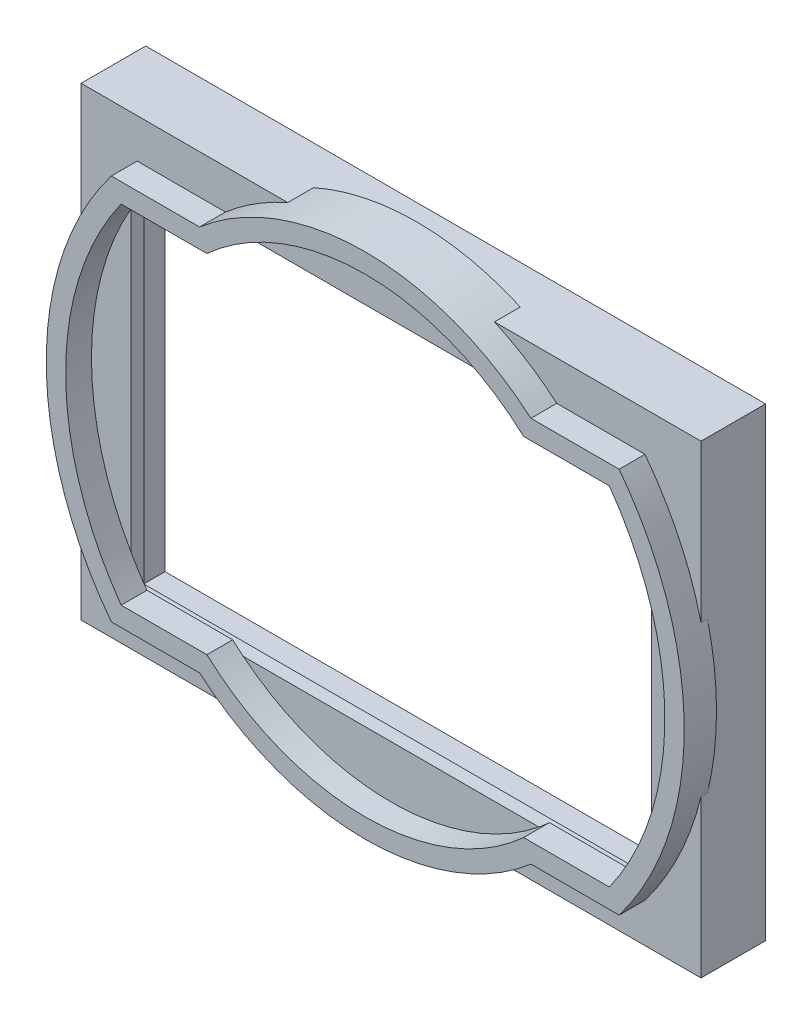
from build123d import *

# Parameters (mm, degrees)
EXTRUDE_1_DEPTH     = 2
EXTRUDE_START       = 2
SKETCH_3_W          = 40.3
SKETCH_3_H          = 28.3
EXTRUDE_2_DEPTH     = 2
SKETCH_4_W          = 48
SKETCH_4_H          = 36
SKETCH_4_W_2        = 45
SKETCH_4_H_2        = 33
EXTRUDE_3_DEPTH     = 3
EXTRUDE_4_DEPTH     = 2
CUT_EXTRUDE_1_DEPTH = 1.5
SKETCH_5_W          = 42.3
SKETCH_5_H          = 30.3
CUT_EXTRUDE_2_DEPTH = 1


with BuildPart() as part:
    # 草图1 → 凸台-拉伸1 (new body)
    with BuildSketch(Plane.XY):
        with BuildLine():
            Line((-19.661828501, 14.95), (-12.82916599, 14.95))
            ThreePointArc((-12.82916599, 14.95), (0, 19.7), (12.82916599, 14.95))
            Line((12.82916599, 14.95), (19.661828501, 14.95))
            ThreePointArc((19.661828501, 14.95), (24.7, 0), (19.661828501, -14.95))
            Line((19.661828501, -14.95), (12.82916599, -14.95))
            ThreePointArc((12.82916599, -14.95), (0, -19.7), (-12.82916599, -14.95))
            Line((-12.82916599, -14.95), (-19.661828501, -14.95))
            ThreePointArc((-19.661828501, -14.95), (-24.7, 0), (-19.661828501, 14.95))
        make_face()
        with BuildLine():
            Line((-18.903372715, 13.45), (-12.261219352, 13.45))
            ThreePointArc((-12.261219352, 13.45), (0, 18.2), (12.261219352, 13.45))
            Line((12.261219352, 13.45), (18.903372715, 13.45))
            ThreePointArc((18.903372715, 13.45), (23.2, 0), (18.903372715, -13.45))
            Line((18.903372715, -13.45), (12.261219352, -13.45))
            ThreePointArc((12.261219352, -13.45), (0, -18.2), (-12.261219352, -13.45))
            Line((-12.261219352, -13.45), (-18.903372715, -13.45))
            ThreePointArc((-18.903372715, -13.45), (-23.2, 0), (-18.903372715, 13.45))
        make_face(mode=Mode.SUBTRACT)
    extrude(amount=EXTRUDE_1_DEPTH)

    # 草图3 → 凸台-拉伸2 (add)
    with BuildSketch(Plane(origin=(0, 0, 0), x_dir=(-1, 0, 0), z_dir=(0, 0, -1)).offset(EXTRUDE_START)):
        with BuildLine():
            Line((-21.5, -12.158947323), (-21.5, -15.5))
            Line((-21.5, -15.5), (-12.158947323, -15.5))
            ThreePointArc((-12.158947323, -15.5), (0, -19.7), (12.158947323, -15.5))
            Line((12.158947323, -15.5), (21.5, -15.5))
            Line((21.5, -15.5), (21.5, -12.158947323))
            ThreePointArc((21.5, -12.158947323), (24.7, 0), (21.5, 12.158947323))
            Line((21.5, 12.158947323), (21.5, 15.5))
            Line((21.5, 15.5), (12.158947323, 15.5))
            ThreePointArc((12.158947323, 15.5), (0, 19.7), (-12.158947323, 15.5))
            Line((-12.158947323, 15.5), (-21.5, 15.5))
            Line((-21.5, 15.5), (-21.5, 12.158947323))
            ThreePointArc((-21.5, 12.158947323), (-24.7, 0), (-21.5, -12.158947323))
        make_face()
        Rectangle(SKETCH_3_W, SKETCH_3_H, mode=Mode.SUBTRACT)
    extrude(amount=-EXTRUDE_2_DEPTH)

    # 草图4 → 凸台-拉伸3 (add)
    with BuildSketch(Plane(origin=(0, 0, -2), x_dir=(-1, 0, 0), z_dir=(0, 0, -1))):
        Rectangle(SKETCH_4_W, SKETCH_4_H)
        Rectangle(SKETCH_4_W_2, SKETCH_4_H_2, mode=Mode.SUBTRACT)
    extrude(amount=EXTRUDE_3_DEPTH)

    # 草图4<2> → 凸台-拉伸4 (add)
    with BuildSketch(Plane(origin=(0, 0, -2), x_dir=(-1, 0, 0), z_dir=(0, 0, -1))):
        with BuildLine():
            ThreePointArc((-21.5, -12.158947323), (-22.968434744, -9.085208055), (-24, -5.838664231))
            Line((-24, -5.838664231), (-24, -18))
            Line((-24, -18), (-8.005623024, -18))
            ThreePointArc((-8.005623024, -18), (-10.159477069, -16.87824119), (-12.158947323, -15.5))
            Line((-12.158947323, -15.5), (-21.5, -15.5))
            Line((-21.5, -15.5), (-21.5, -12.158947323))
        make_face()
        with BuildLine():
            ThreePointArc((12.158947323, -15.5), (10.159477069, -16.87824119), (8.005623024, -18))
            Line((8.005623024, -18), (24, -18))
            Line((24, -18), (24, -5.838664231))
            ThreePointArc((24, -5.838664231), (22.968434744, -9.085208055), (21.5, -12.158947323))
            Line((21.5, -12.158947323), (21.5, -15.5))
            Line((21.5, -15.5), (12.158947323, -15.5))
        make_face()
        with BuildLine():
            ThreePointArc((-24, 5.838664231), (-22.968434744, 9.085208055), (-21.5, 12.158947323))
            Line((-21.5, 12.158947323), (-21.5, 15.5))
            Line((-21.5, 15.5), (-12.158947323, 15.5))
            ThreePointArc((-12.158947323, 15.5), (-10.159477069, 16.87824119), (-8.005623024, 18))
            Line((-8.005623024, 18), (-24, 18))
            Line((-24, 18), (-24, 5.838664231))
        make_face()
        with BuildLine():
            ThreePointArc((21.5, 12.158947323), (22.968434744, 9.085208055), (24, 5.838664231))
            Line((24, 5.838664231), (24, 18))
            Line((24, 18), (8.005623024, 18))
            ThreePointArc((8.005623024, 18), (10.159477069, 16.87824119), (12.158947323, 15.5))
            Line((12.158947323, 15.5), (21.5, 15.5))
            Line((21.5, 15.5), (21.5, 12.158947323))
        make_face()
    extrude(amount=-EXTRUDE_4_DEPTH)

    # 草图4<3> → 切除-拉伸1 (cut)
    with BuildSketch(Plane(origin=(0, 0, -2), x_dir=(-1, 0, 0), z_dir=(0, 0, -1))):
        with BuildLine():
            ThreePointArc((-24, 5.838664231), (-24.7, 0), (-24, -5.838664231))
            Line((-24, -5.838664231), (-24, 5.838664231))
        make_face()
        with BuildLine():
            Line((24, 5.838664231), (24, -5.838664231))
            ThreePointArc((24, -5.838664231), (24.7, 0), (24, 5.838664231))
        make_face()
    extrude(amount=-CUT_EXTRUDE_1_DEPTH, mode=Mode.SUBTRACT)

    # 草图5 → 切除-拉伸2 (cut)
    with BuildSketch(Plane(origin=(0, 0, -2), x_dir=(-1, 0, 0), z_dir=(0, 0, -1))):
        Rectangle(SKETCH_5_W, SKETCH_5_H)
    extrude(amount=-CUT_EXTRUDE_2_DEPTH, mode=Mode.SUBTRACT)


solid = part.part
